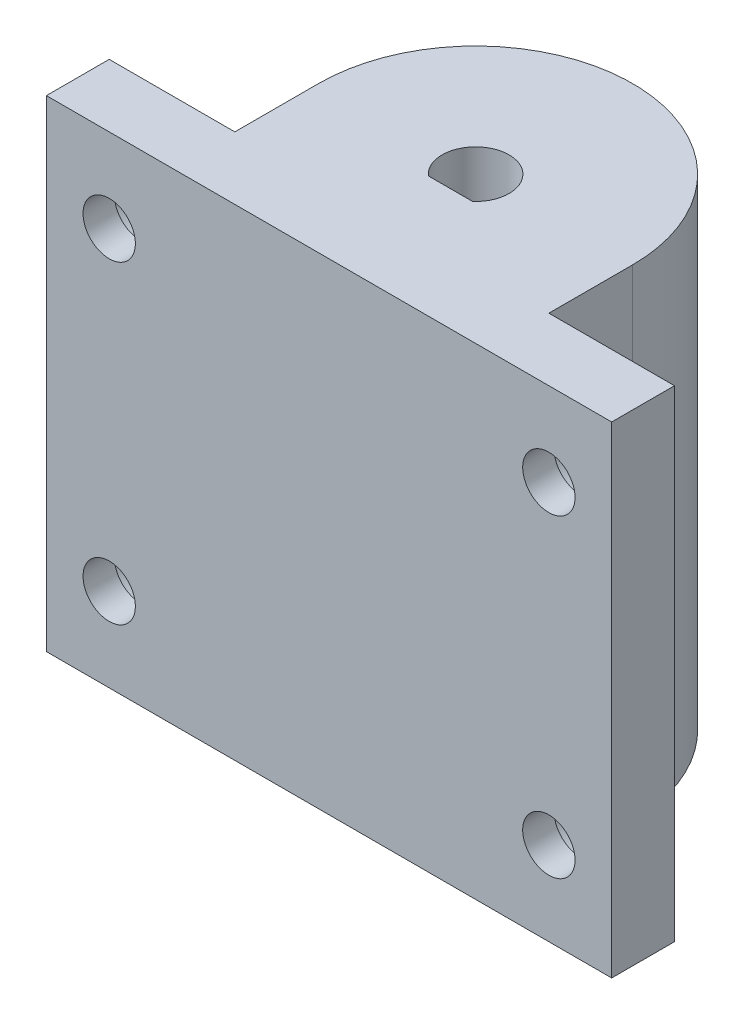
from build123d import *

# Parameters (mm, degrees)
SKETCH_2_W          = 170
SKETCH_2_H          = 20
EXTRUDE_1_DEPTH     = 23
CUT_EXTRUDE_1_DEPTH = 173.710740836
SKETCH_4_W          = 17
SKETCH_4_H          = 13
CUT_EXTRUDE_2_DEPTH = 30
CUT_EXTRUDE_3_DEPTH = 173.710740836
SKETCH_6_W          = 17.5
SKETCH_6_H          = 14.5
CUT_EXTRUDE_4_DEPTH = 173.710740836
SKETCH_7_W          = 27
SKETCH_7_H          = 23
SKETCH_7_R          = 1.25
EXTRUDE_2_DEPTH     = 3
CUT_EXTRUDE_START   = -3
SKETCH_7_3_R        = 2
CUT_EXTRUDE_5_DEPTH = 1.5


with BuildPart() as part:
    # 草图2 → 凸台-拉伸1 (new body)
    with BuildSketch(Plane(origin=(0, 0, 0), x_dir=(1, 0, 0), z_dir=(0, 1, 0))):
        with Locations((85, -10)):
            Rectangle(SKETCH_2_W, SKETCH_2_H)
    extrude(amount=EXTRUDE_1_DEPTH)

    # 草图3 → 切除-拉伸1 (cut, through all)
    with BuildSketch(Plane(origin=(0, 23, 0), x_dir=(1, 0, 0), z_dir=(0, 1, 0))):
        with BuildLine():
            ThreePointArc((161.6, -10), (159.341699476, -8.541699476), (158.941699476, -11.2))
            Line((158.941699476, -11.2), (161.058300524, -11.2))
            ThreePointArc((161.058300524, -11.2), (161.458300524, -10.658300524), (161.6, -10))
        make_face()
        with BuildLine():
            ThreePointArc((126.6, -10), (124.341699476, -8.541699476), (123.941699476, -11.2))
            Line((123.941699476, -11.2), (126.058300524, -11.2))
            ThreePointArc((126.058300524, -11.2), (126.458300524, -10.658300524), (126.6, -10))
        make_face()
    extrude(amount=-CUT_EXTRUDE_1_DEPTH, mode=Mode.SUBTRACT)

    # 草图4 → 切除-拉伸2 (cut)
    with BuildSketch(Plane(origin=(170, 0, 0), x_dir=(0, 0, -1), z_dir=(1, 0, 0))):
        with Locations((-8.5, 11.5)):
            Rectangle(SKETCH_4_W, SKETCH_4_H)
    extrude(amount=-CUT_EXTRUDE_2_DEPTH, mode=Mode.SUBTRACT)

    # 草图5 → 切除-拉伸3 (cut, through all)
    with BuildSketch(Plane(origin=(0, 23, 0), x_dir=(1, 0, 0), z_dir=(0, 1, 0))):
        with BuildLine():
            Line((117.5, -17), (117.5, -10))
            ThreePointArc((117.5, -10), (125, -2.5), (132.5, -10))
            Line((132.5, -10), (132.5, -17))
            Line((132.5, -17), (152.5, -17))
            Line((152.5, -17), (152.5, -10))
            ThreePointArc((152.5, -10), (160, -2.5), (167.5, -10))
            Line((167.5, -10), (167.5, -17))
            Line((167.5, -17), (170, -17))
            Line((170, -17), (170, 0))
            Line((170, 0), (0, 0))
            Line((0, 0), (0, -20))
            Line((0, -20), (102.5, -20))
            Line((102.5, -20), (102.5, -17))
            Line((102.5, -17), (117.5, -17))
        make_face()
    extrude(amount=-CUT_EXTRUDE_3_DEPTH, mode=Mode.SUBTRACT)

    # 草图6 → 切除-拉伸4 (cut, through all)
    with BuildSketch(Plane(origin=(0, 23, 0), x_dir=(1, 0, 0), z_dir=(0, 1, 0))):
        Polygon((152.5, -17), (102.5, -17), (102.5, -20), (170, -20), (170, -17), align=None)
        with Locations((161.25, -9.75)):
            Rectangle(SKETCH_6_W, SKETCH_6_H)
    extrude(amount=-CUT_EXTRUDE_4_DEPTH, mode=Mode.SUBTRACT)

    # 草图7 → 凸台-拉伸2 (add)
    with BuildSketch(Plane.XY.offset(17)):
        with Locations((125, 11.5)):
            Rectangle(SKETCH_7_W, SKETCH_7_H)
        with Locations((114.5, 19)):
            Circle(SKETCH_7_R, mode=Mode.SUBTRACT)
        with Locations((114.5, 4)):
            Circle(SKETCH_7_R, mode=Mode.SUBTRACT)
        with Locations((135.5, 4)):
            Circle(SKETCH_7_R, mode=Mode.SUBTRACT)
        with Locations((135.5, 19)):
            Circle(SKETCH_7_R, mode=Mode.SUBTRACT)
    extrude(amount=-EXTRUDE_2_DEPTH)

    # 草图7<3> → 切除-拉伸5 (cut)
    with BuildSketch(Plane.XY.offset(17).offset(CUT_EXTRUDE_START)):
        with Locations(Location((114.5, 19, 0), (0, 0, 180))):
            Circle(SKETCH_7_3_R)
        with Locations(Location((114.5, 4, 0), (0, 0, 180))):
            Circle(SKETCH_7_3_R)
        with Locations(Location((135.5, 4, 0), (0, 0, 180))):
            Circle(SKETCH_7_3_R)
        with Locations(Location((135.5, 19, 0), (0, 0, 180))):
            Circle(SKETCH_7_3_R)
    extrude(amount=CUT_EXTRUDE_5_DEPTH, mode=Mode.SUBTRACT)


solid = part.part
